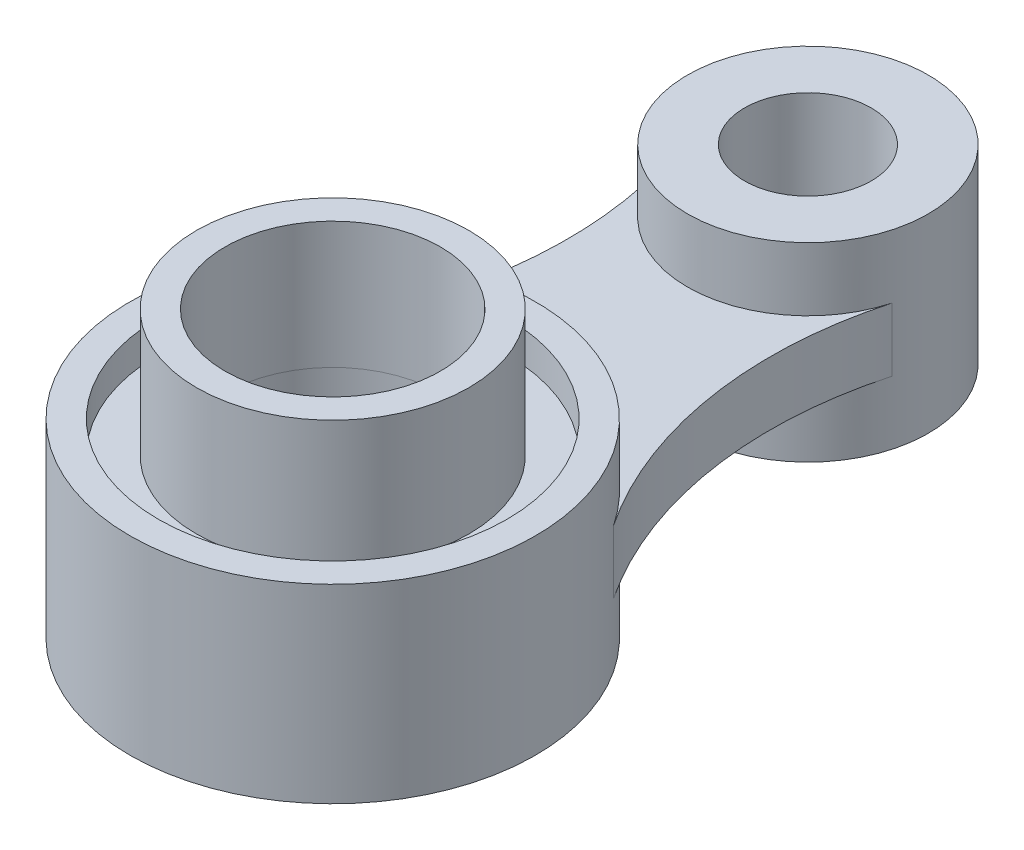
from build123d import *

# Parameters (mm, degrees)
SKETCH2_R               = 19
BOSS_EXTRUDE1_DEPTH     = 30
SKETCH2_R_2             = 32
BOSS_EXTRUDE1_2_DEPTH   = 30
BOSS_EXTRUDE2_DEPTH     = 10
SKETCH4_R               = 27.5
CUT_EXTRUDE1_DEPTH      = 5
SKETCH5_R               = 21.5
BOSS_EXTRUDE3_DEPTH     = 20
CUT_EXTRUDE3_DEPTH      = 89.765139554
CUT_EXTRUDE3_DEPTH_BACK = 89.765139554
SKETCH6_R               = 10
SKETCH6_R_2             = 17


with BuildPart() as part:
    # Sketch2 → Boss-Extrude1 (new body)
    with BuildSketch(Plane(origin=(0, 0, 0), x_dir=(1, 0, 0), z_dir=(0, 1, 0))):
        with Locations(Location((0, 37.5, 0), (0, 0, 270))):
            Circle(SKETCH2_R)
    extrude(amount=BOSS_EXTRUDE1_DEPTH)



with BuildPart() as body_2:
    # Sketch2 → Boss-Extrude1 2 (new body)
    with BuildSketch(Plane(origin=(0, 0, 0), x_dir=(1, 0, 0), z_dir=(0, 1, 0))):
        with Locations(Location((0, -37.5, 0), (0, 0, 270))):
            Circle(SKETCH2_R_2)
    extrude(amount=BOSS_EXTRUDE1_2_DEPTH)


with BuildPart() as part_1:
    add(part.part)

    add(body_2.part)  # Boss-Extrude2 merges body 2
    # Sketch3 → Boss-Extrude2 (add)
    with BuildSketch(Plane(origin=(0, 10, 0), x_dir=(1, 0, 0), z_dir=(0, 1, 0))):
        with BuildLine():
            ThreePointArc((-18.321243986, 32.466907631), (0, 18.5), (18.321243986, 32.466907631))
            ThreePointArc((18.321243986, 32.466907631), (16.836772686, 5.414041255), (26.678302647, -19.828888889))
            ThreePointArc((26.678302647, -19.828888889), (0, -5.5), (-26.678302647, -19.828888889))
            ThreePointArc((-26.678302647, -19.828888889), (-16.836772686, 5.414041255), (-18.321243986, 32.466907631))
        make_face()
    extrude(amount=BOSS_EXTRUDE2_DEPTH)

    # Sketch4 → Cut-Extrude1 (cut)
    with BuildSketch(Plane(origin=(0, 25, 0), x_dir=(1, 0, 0), z_dir=(0, 1, 0))):
        with Locations(Location((0, -37.5, 0), (0, 0, 270))):
            Circle(SKETCH4_R)
    extrude(amount=CUT_EXTRUDE1_DEPTH, mode=Mode.SUBTRACT)


with BuildPart() as body_2_2:
    # Sketch5 → Boss-Extrude3 (new body)
    with BuildSketch(Plane(origin=(0, 25, 0), x_dir=(1, 0, 0), z_dir=(0, 1, 0))):
        with Locations(Location((0, -37.5, 0), (0, 0, 270))):
            Circle(SKETCH5_R)
    extrude(amount=BOSS_EXTRUDE3_DEPTH)


with BuildPart() as cut_extrude3_tool:
    # Sketch6 → Cut-Extrude3 (new, two sides: drawn at the far end of the back side and taken through both)
    with BuildSketch(Plane(origin=(0, 0, 0), x_dir=(1, 0, 0), z_dir=(0, 1, 0)).offset(-CUT_EXTRUDE3_DEPTH_BACK)):
        with Locations(Location((0, 37.5, 0), (0, 0, 90))):
            Circle(SKETCH6_R)
        with Locations(Location((0, -37.5, 0), (0, 0, 90))):
            Circle(SKETCH6_R_2)
    extrude(amount=CUT_EXTRUDE3_DEPTH + CUT_EXTRUDE3_DEPTH_BACK)


with BuildPart() as part_2:
    add(part_1.part)

    # Cut-Extrude3: cut by cut_extrude3_tool
    add(cut_extrude3_tool.part, mode=Mode.SUBTRACT)


with BuildPart() as body_2_2_1:
    add(body_2_2.part)

    # Cut-Extrude3: cut by cut_extrude3_tool
    add(cut_extrude3_tool.part, mode=Mode.SUBTRACT)


solid = Compound([part_2.part, body_2_2_1.part])
